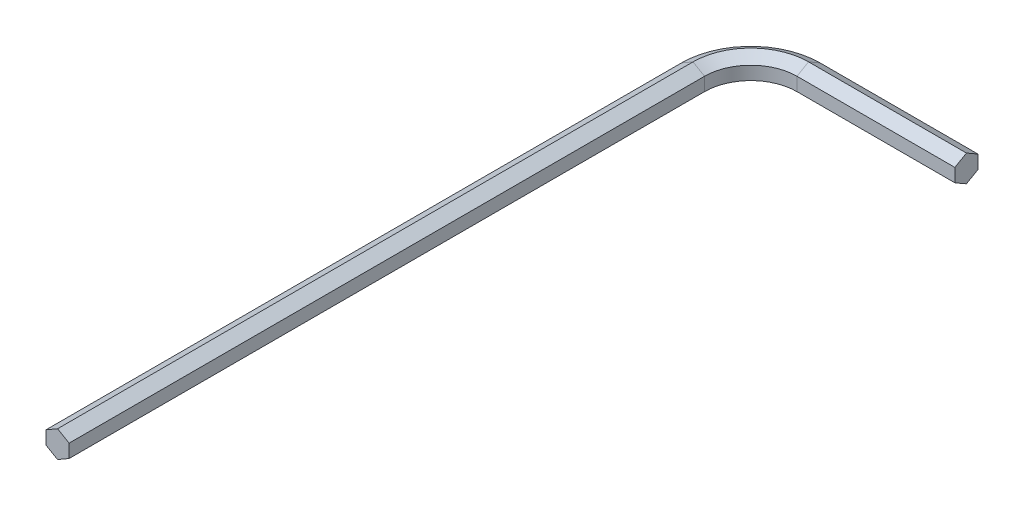
from build123d import *


with BuildPart() as part:
    # Sweep1: sweep along a path in Sketch1
    with BuildLine(Plane(origin=(0, 0, 0), x_dir=(1, 0, 0), z_dir=(0, 1, 0))) as sweep1_path:
        Line((0, 0), (0, 41.25))
        ThreePointArc((0, 41.25), (1.098349571, 43.901650429), (3.75, 45))
        Line((3.75, 45), (14, 45))
    # Sketch2 → Sweep1 (sweep)
    with BuildSketch(Plane.XY):
        Polygon((0, -0.866025404), (0.75, -0.433012702), (0.75, 0.433012702), (0, 0.866025404), (-0.75, 0.433012702), (-0.75, -0.433012702), align=None)
    sweep(path=sweep1_path.line)


solid = part.part
